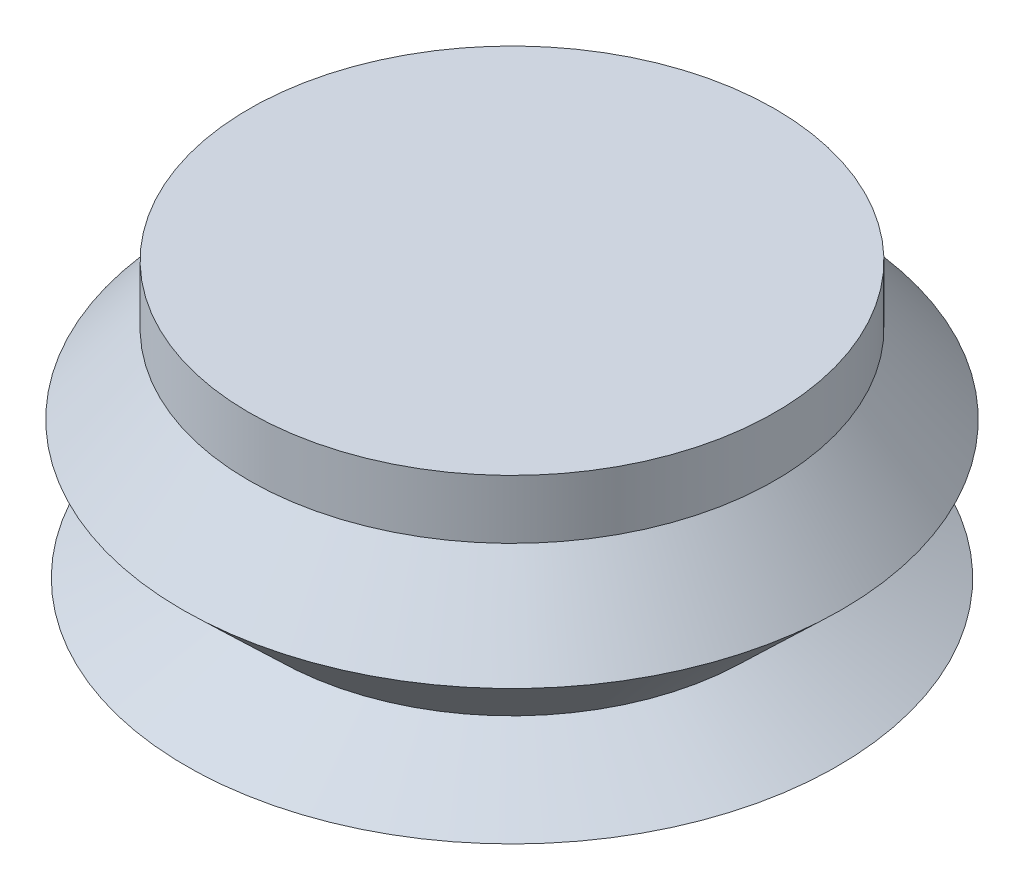
from build123d import *


with BuildPart() as part:
    # 草图1 → 旋转1 (revolve)
    with BuildSketch(Plane.XY, mode=Mode.PRIVATE) as revolve_1_sk:
        Polygon((0, 0), (0, 35), (33.5, 35), (33.5, 27.5), (42, 17.5), (30, 6), (41.5, 0), align=None)
    revolve(revolve_1_sk.sketch.rotate(Axis((0, 0, 0), (0, 1, 0)), 90), axis=Axis((0, 0, 0), (0, 1, 0)))


solid = part.part
